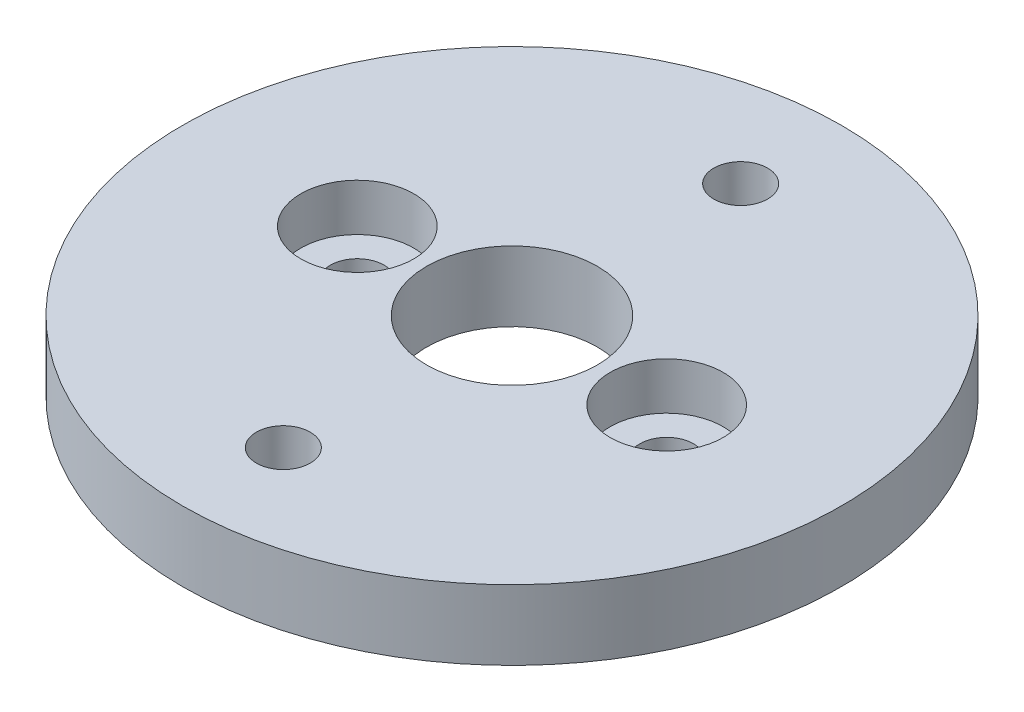
from build123d import *

# Parameters (mm, degrees)
SKETCH1_R           = 12.25
BOSS_EXTRUDE1_DEPTH = 2.6
CUT_EXTRUDE1_REACH  = 19.518
SKETCH2_R           = 3.175
SKETCH2_R_2         = 1
SKETCH3_R           = 2.1
CUT_EXTRUDE2_DEPTH  = 1.75


with BuildPart() as part:
    # Sketch1 → Boss-Extrude1 (new body)
    with BuildSketch(Plane(origin=(0, 0, 0), x_dir=(1, 0, 0), z_dir=(0, 1, 0))):
        with Locations(Location((0, 0, 0), (0, 0, 270))):
            Circle(SKETCH1_R)
    extrude(amount=BOSS_EXTRUDE1_DEPTH)

    # Sketch2 → Cut-Extrude1 (cut, up to next)
    with BuildSketch(Plane.XZ, mode=Mode.PRIVATE) as cut_extrude1_sk1:
        with Locations(Location((0, 0, 0), (0, 0, 270))):
            Circle(SKETCH2_R)
    cut_extrude1_tool1 = extrude(cut_extrude1_sk1.sketch, amount=-CUT_EXTRUDE1_REACH, mode=Mode.PRIVATE) & part.part
    # Sketch2 → Cut-Extrude1 (cut, up to next)
    with BuildSketch(Plane.XZ, mode=Mode.PRIVATE) as cut_extrude1_sk2:
        with Locations(Location((0, 8.5, 0), (0, 0, 270))):
            Circle(SKETCH2_R_2)
    cut_extrude1_tool2 = extrude(cut_extrude1_sk2.sketch, amount=-CUT_EXTRUDE1_REACH, mode=Mode.PRIVATE) & part.part
    # Sketch2 → Cut-Extrude1 (cut, up to next)
    with BuildSketch(Plane.XZ, mode=Mode.PRIVATE) as cut_extrude1_sk3:
        with Locations(Location((0, -8.5, 0), (0, 0, 270))):
            Circle(SKETCH2_R_2)
    cut_extrude1_tool3 = extrude(cut_extrude1_sk3.sketch, amount=-CUT_EXTRUDE1_REACH, mode=Mode.PRIVATE) & part.part
    # Sketch2 → Cut-Extrude1 (cut, up to next)
    with BuildSketch(Plane.XZ, mode=Mode.PRIVATE) as cut_extrude1_sk4:
        with Locations(Location((-5.75, 0, 0), (0, 0, 270))):
            Circle(SKETCH2_R_2)
    cut_extrude1_tool4 = extrude(cut_extrude1_sk4.sketch, amount=-CUT_EXTRUDE1_REACH, mode=Mode.PRIVATE) & part.part
    # Sketch2 → Cut-Extrude1 (cut, up to next)
    with BuildSketch(Plane.XZ, mode=Mode.PRIVATE) as cut_extrude1_sk5:
        with Locations(Location((5.75, 0, 0), (0, 0, 270))):
            Circle(SKETCH2_R_2)
    cut_extrude1_tool5 = extrude(cut_extrude1_sk5.sketch, amount=-CUT_EXTRUDE1_REACH, mode=Mode.PRIVATE) & part.part
    add(cut_extrude1_tool1.solids().sort_by_distance((0, 0, 0))[0], mode=Mode.SUBTRACT)
    add(cut_extrude1_tool2.solids().sort_by_distance((0, 0, 8.5))[0], mode=Mode.SUBTRACT)
    add(cut_extrude1_tool3.solids().sort_by_distance((0, 0, -8.5))[0], mode=Mode.SUBTRACT)
    add(cut_extrude1_tool4.solids().sort_by_distance((-5.75, 0, 0))[0], mode=Mode.SUBTRACT)
    add(cut_extrude1_tool5.solids().sort_by_distance((5.75, 0, 0))[0], mode=Mode.SUBTRACT)

    # Sketch3 → Cut-Extrude2 (cut)
    with BuildSketch(Plane(origin=(0, 2.6, 0), x_dir=(1, 0, 0), z_dir=(0, 1, 0))):
        with Locations(Location((-5.75, 0, 0), (0, 0, 270))):
            Circle(SKETCH3_R)
        with Locations(Location((5.75, 0, 0), (0, 0, 270))):
            Circle(SKETCH3_R)
    extrude(amount=-CUT_EXTRUDE2_DEPTH, mode=Mode.SUBTRACT)


solid = part.part
